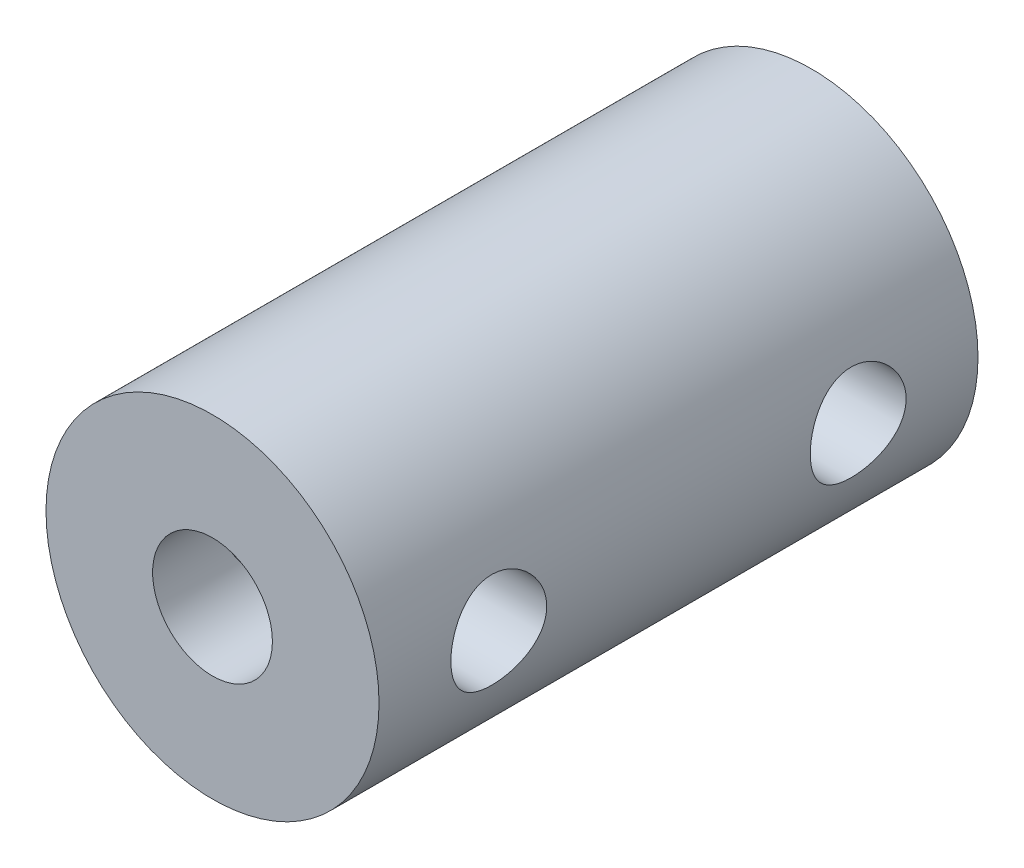
from build123d import *

# Parameters (mm, degrees)
SKETCH_1_R          = 6.95
SKETCH_1_R_2        = 2.5
EXTRUDE_1_DEPTH     = 25
SKETCH_2_R          = 2
CUT_EXTRUDE_1_DEPTH = 30.436584381


with BuildPart() as part:
    # 草图1 → 凸台-拉伸1 (new body)
    with BuildSketch(Plane.XY):
        Circle(SKETCH_1_R)
        Circle(SKETCH_1_R_2, mode=Mode.SUBTRACT)
    extrude(amount=EXTRUDE_1_DEPTH)

    # 草图2 → 切除-拉伸1 (cut, through all)
    with BuildSketch(Plane(origin=(6.95, 0, 0), x_dir=(0, 0, -1), z_dir=(1, 0, 0))):
        with Locations((-5, 0)):
            Circle(SKETCH_2_R)
        with Locations((-20, 0)):
            Circle(SKETCH_2_R)
    extrude(amount=-CUT_EXTRUDE_1_DEPTH, mode=Mode.SUBTRACT)


solid = part.part
